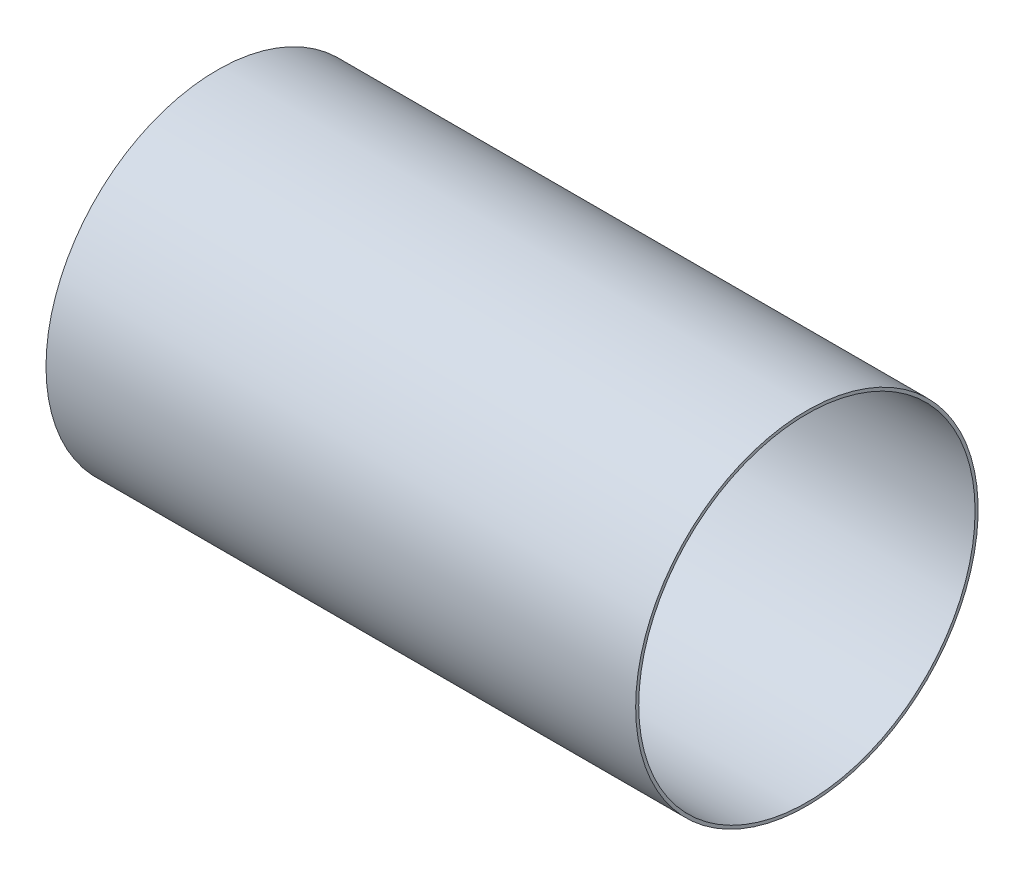
from build123d import *

# Parameters (mm, degrees)
SKETCH1_R           = 88.519
SKETCH1_R_2         = 86.9315
BOSS_EXTRUDE1_DEPTH = 304.8


with BuildPart() as part:
    # Sketch1 → Boss-Extrude1 (new body)
    with BuildSketch(Plane.YZ):
        with Locations(Location((0, 0, 0), (0, 0, 90))):
            Circle(SKETCH1_R)
        with Locations(Location((0, 0, 0), (0, 0, 90))):
            Circle(SKETCH1_R_2, mode=Mode.SUBTRACT)
    extrude(amount=BOSS_EXTRUDE1_DEPTH)


solid = part.part
